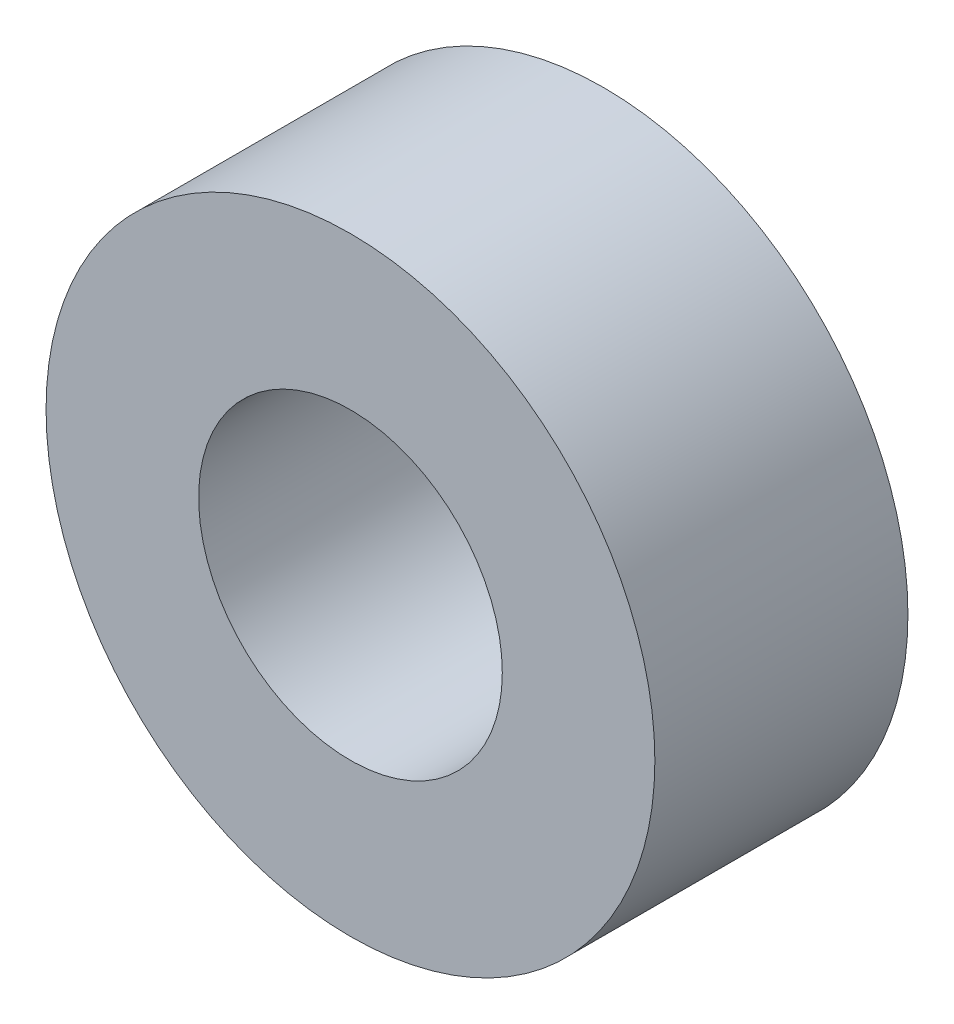
from build123d import *

# Parameters (mm, degrees)
SKETCH_2_R      = 3.007095074
SKETCH_2_R_2    = 1.5
EXTRUDE_1_DEPTH = 2.5


with BuildPart() as part:
    # 草图2 → 凸台-拉伸1 (new body)
    with BuildSketch(Plane.XY):
        Circle(SKETCH_2_R)
        Circle(SKETCH_2_R_2, mode=Mode.SUBTRACT)
    extrude(amount=EXTRUDE_1_DEPTH)


solid = part.part
